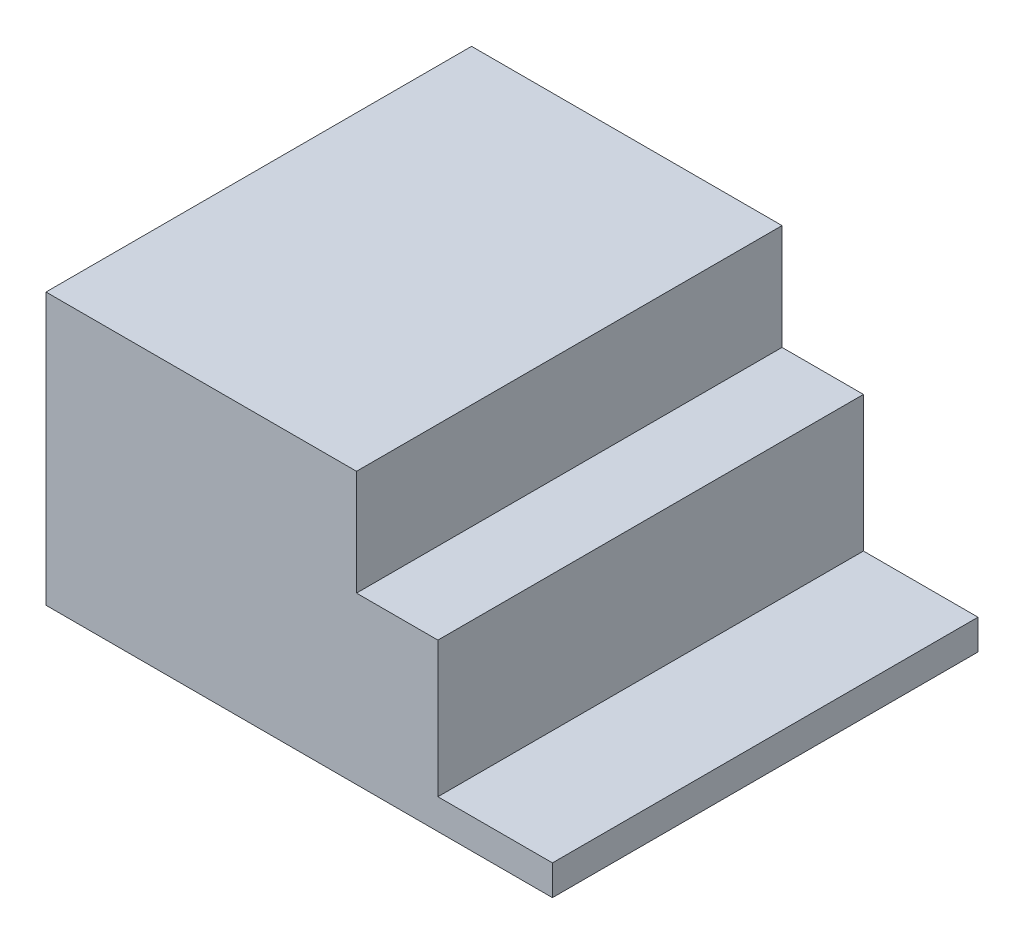
from build123d import *

# Parameters (mm, degrees)
SKETCH1_W               = 168
SKETCH1_H               = 141.165136176
BOSS_EXTRUDE1_DEPTH     = 90
CUT_EXTRUDE1_DEPTH      = 170.43110375
CUT_EXTRUDE1_DEPTH_BACK = 170.43110375


with BuildPart() as part:
    # Sketch1 → Boss-Extrude1 (new body)
    with BuildSketch(Plane(origin=(0, 0, 0), x_dir=(1, 0, 0), z_dir=(0, 1, 0))):
        with Locations((41, 0)):
            Rectangle(SKETCH1_W, SKETCH1_H)
    extrude(amount=BOSS_EXTRUDE1_DEPTH)

    # Sketch2 → Cut-Extrude1 (cut, two sides: drawn at the far end of the back side and taken through both)
    with BuildSketch(Plane.XY.offset(-CUT_EXTRUDE1_DEPTH_BACK)):
        Polygon((125, 90), (125, 10), (87, 10), (87, 55), (60, 55), (60, 90), align=None)
    extrude(amount=CUT_EXTRUDE1_DEPTH + CUT_EXTRUDE1_DEPTH_BACK, mode=Mode.SUBTRACT)


solid = part.part
